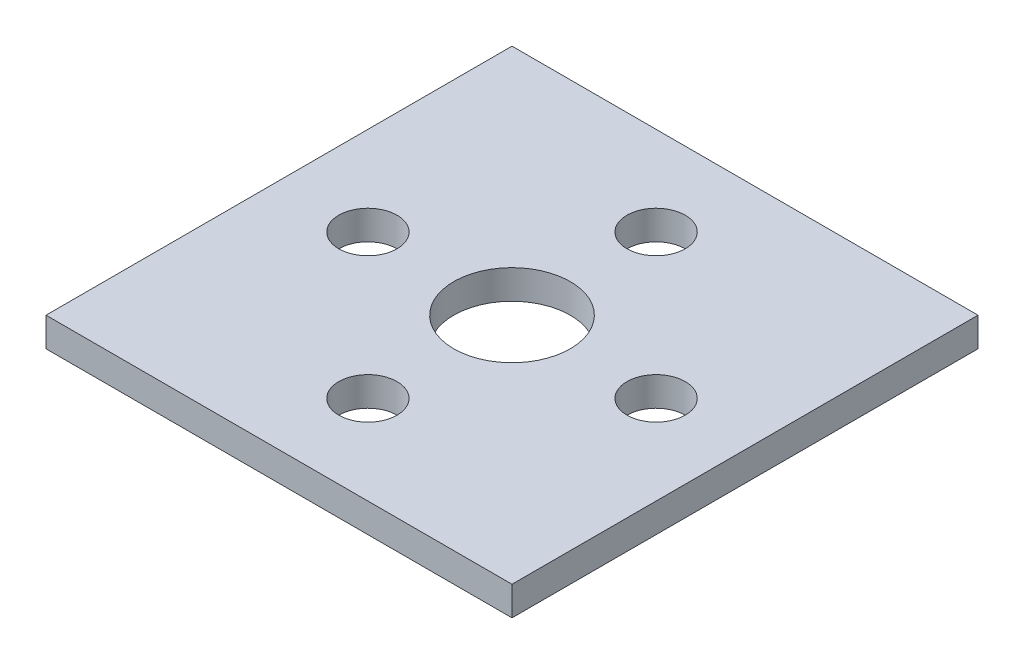
from build123d import *

# Parameters (mm, degrees)
SKETCH1_W           = 50.8
SKETCH1_H           = 50.8
SKETCH1_R           = 6.35
SKETCH1_R_2         = 3.175
BOSS_EXTRUDE1_DEPTH = 3.175


with BuildPart() as part:
    # Sketch1 → Boss-Extrude1 (new body)
    with BuildSketch(Plane(origin=(0, 0, 0), x_dir=(1, 0, 0), z_dir=(0, 1, 0))):
        with Locations((25.4, 25.4)):
            Rectangle(SKETCH1_W, SKETCH1_H)
        with Locations(Location((25.4, 25.4, 0), (0, 0, 270))):
            Circle(SKETCH1_R, mode=Mode.SUBTRACT)
        with Locations(Location((25.4, 41.109236948, 0), (0, 0, 270))):
            Circle(SKETCH1_R_2, mode=Mode.SUBTRACT)
        with Locations(Location((41.109236948, 25.4, 0), (0, 0, 270))):
            Circle(SKETCH1_R_2, mode=Mode.SUBTRACT)
        with Locations(Location((25.4, 9.690763052, 0), (0, 0, 270))):
            Circle(SKETCH1_R_2, mode=Mode.SUBTRACT)
        with Locations(Location((9.690763052, 25.4, 0), (0, 0, 270))):
            Circle(SKETCH1_R_2, mode=Mode.SUBTRACT)
    extrude(amount=BOSS_EXTRUDE1_DEPTH)


solid = part.part
